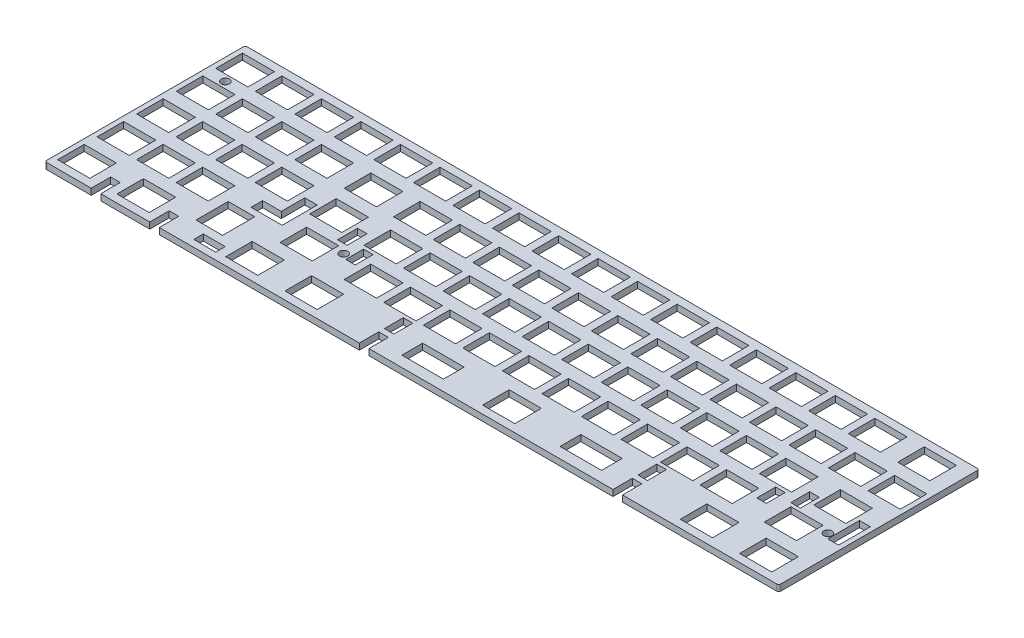
from build123d import *

# Parameters (mm, degrees)
SKETCH1_R           = 2
SKETCH1_W           = 10.6
SKETCH1_H           = 4.6
SKETCH1_W_2         = 4.6
SKETCH1_H_2         = 8.6
SKETCH1_H_3         = 9.6
SKETCH1_H_4         = 9.1
SKETCH1_W_3         = 5.2375
SKETCH1_H_5         = 15.35
SKETCH1_W_4         = 20
SKETCH1_H_6         = 10
SKETCH1_W_5         = 15.6
SKETCH1_H_7         = 12.8
SKETCH1_W_6         = 15.5
SKETCH1_W_7         = 12.8
SKETCH1_H_8         = 15.5
BOSS_EXTRUDE1_DEPTH = 3


with BuildPart() as part:
    # Sketch1 → Boss-Extrude1 (new body)
    with BuildSketch(Plane(origin=(0, 0, 0), x_dir=(1, 0, 0), z_dir=(0, 1, 0))):
        with BuildLine():
            Line((22.374999588, 5.73e-07), (22.374999588, 9.350000573))
            Line((22.374999588, 9.350000573), (26.974999588, 9.350000573))
            Line((26.974999588, 9.350000573), (26.974999588, 5.73e-07))
            Line((26.974999588, 5.73e-07), (50.574999588, 5.73e-07))
            Line((50.574999588, 5.73e-07), (50.574999588, 9.350000573))
            Line((50.574999588, 9.350000573), (55.174999588, 9.350000573))
            Line((55.174999588, 9.350000573), (55.174999588, 5.73e-07))
            Line((55.174999588, 5.73e-07), (151.587499588, 5.73e-07))
            Line((151.587499588, 5.73e-07), (151.587499588, 9.350000573))
            Line((151.587499588, 9.350000573), (156.187499588, 9.350000573))
            Line((156.187499588, 9.350000573), (156.187499588, 5.73e-07))
            Line((156.187499588, 5.73e-07), (273.787499588, 5.73e-07))
            Line((273.787499588, 5.73e-07), (273.787499588, 9.350000573))
            Line((273.787499588, 9.350000573), (278.387499588, 9.350000573))
            Line((278.387499588, 9.350000573), (278.387499588, 5.73e-07))
            Line((278.387499588, 5.73e-07), (352.674999588, 5.73e-07))
            ThreePointArc((352.674999588, 5.73e-07), (353.382106369, 0.292893792), (353.674999588, 1.000000573))
            Line((353.674999588, 1.000000573), (353.674999588, 95.600000573))
            ThreePointArc((353.674999588, 95.600000573), (353.382106369, 96.307107354), (352.674999588, 96.600000573))
            Line((352.674999588, 96.600000573), (0.999999588, 96.600000573))
            ThreePointArc((0.999999588, 96.600000573), (0.292892807, 96.307107354), (-4.12e-07, 95.600000573))
            Line((-4.12e-07, 95.600000573), (-4.12e-07, 1.000000573))
            ThreePointArc((-4.12e-07, 1.000000573), (0.292892807, 0.292893792), (0.999999588, 5.73e-07))
            Line((0.999999588, 5.73e-07), (22.374999588, 5.73e-07))
        make_face()
        with Locations(Location((343.868749588, 33.500000573, 0), (0, 0, 270))):
            Circle(SKETCH1_R, mode=Mode.SUBTRACT)
        with Locations(Location((110.506249588, 33.500000573, 0), (0, 0, 270))):
            Circle(SKETCH1_R, mode=Mode.SUBTRACT)
        with Locations(Location((10.149999588, 76.875000573, 0), (0, 0, 270))):
            Circle(SKETCH1_R, mode=Mode.SUBTRACT)
        Polygon((83.843749588, 47.450000573), (83.843749588, 30.525000573), (68.843749588, 30.525000573), (68.843749588, 36.125000573), (77.843749588, 36.125000573), (77.843749588, 47.450000573), align=None, mode=Mode.SUBTRACT)
        with Locations((73.749999588, 5.625000573)):
            Rectangle(SKETCH1_W, SKETCH1_H, mode=Mode.SUBTRACT)
        with Locations((115.706249588, 35.900000573)):
            Rectangle(SKETCH1_W_2, SKETCH1_H_2, mode=Mode.SUBTRACT)
        with Locations((105.543749588, 42.650000573)):
            Rectangle(SKETCH1_W_2, SKETCH1_H_3, mode=Mode.SUBTRACT)
        with Locations((153.887499588, 16.600000573)):
            Rectangle(SKETCH1_W_2, SKETCH1_H_4, mode=Mode.SUBTRACT)
        with Locations((276.087499588, 16.600000573)):
            Rectangle(SKETCH1_W_2, SKETCH1_H_4, mode=Mode.SUBTRACT)
        with Locations((324.431252401, 41.900000311)):
            Rectangle(SKETCH1_W_2, SKETCH1_H_4, mode=Mode.SUBTRACT)
        with Locations((314.268749588, 35.650000573)):
            Rectangle(SKETCH1_W_2, SKETCH1_H_4, mode=Mode.SUBTRACT)
        with Locations((348.749999588, 38.775000573)):
            Rectangle(SKETCH1_W_3, SKETCH1_H_5, mode=Mode.SUBTRACT)
        with Locations((176.887499588, 10.200000573)):
            Rectangle(SKETCH1_W_4, SKETCH1_H_6, mode=Mode.SUBTRACT)
        with Locations((253.087499588, 10.200000573)):
            Rectangle(SKETCH1_W_4, SKETCH1_H_6, mode=Mode.SUBTRACT)
        with Locations((129.212499588, 29.250000573)):
            Rectangle(SKETCH1_W_5, SKETCH1_H_7, mode=Mode.SUBTRACT)
        with Locations((119.687499588, 48.300000573)):
            Rectangle(SKETCH1_W_5, SKETCH1_H_7, mode=Mode.SUBTRACT)
        with Locations((114.924999588, 67.350000573)):
            Rectangle(SKETCH1_W_5, SKETCH1_H_7, mode=Mode.SUBTRACT)
        with Locations((338.762499588, 86.400000573)):
            Rectangle(SKETCH1_W_6, SKETCH1_H_7, mode=Mode.SUBTRACT)
        with Locations((314.949999588, 86.400000573)):
            Rectangle(SKETCH1_W_6, SKETCH1_H_7, mode=Mode.SUBTRACT)
        with Locations((295.899999588, 86.400000573)):
            Rectangle(SKETCH1_W_6, SKETCH1_H_7, mode=Mode.SUBTRACT)
        with Locations((276.849999588, 86.400000573)):
            Rectangle(SKETCH1_W_6, SKETCH1_H_7, mode=Mode.SUBTRACT)
        with Locations((257.799999588, 86.400000573)):
            Rectangle(SKETCH1_W_6, SKETCH1_H_7, mode=Mode.SUBTRACT)
        with Locations((238.749999588, 86.400000573)):
            Rectangle(SKETCH1_W_6, SKETCH1_H_7, mode=Mode.SUBTRACT)
        with Locations((219.699999588, 86.400000573)):
            Rectangle(SKETCH1_W_6, SKETCH1_H_7, mode=Mode.SUBTRACT)
        with Locations((200.649999588, 86.400000573)):
            Rectangle(SKETCH1_W_6, SKETCH1_H_7, mode=Mode.SUBTRACT)
        with Locations((181.599999588, 86.400000573)):
            Rectangle(SKETCH1_W_6, SKETCH1_H_7, mode=Mode.SUBTRACT)
        with Locations((162.549999588, 86.400000573)):
            Rectangle(SKETCH1_W_6, SKETCH1_H_7, mode=Mode.SUBTRACT)
        with Locations((143.499999588, 86.400000573)):
            Rectangle(SKETCH1_W_6, SKETCH1_H_7, mode=Mode.SUBTRACT)
        with Locations((124.449999588, 86.400000573)):
            Rectangle(SKETCH1_W_6, SKETCH1_H_7, mode=Mode.SUBTRACT)
        with Locations((105.399999588, 86.400000573)):
            Rectangle(SKETCH1_W_6, SKETCH1_H_7, mode=Mode.SUBTRACT)
        with Locations((86.349999588, 86.400000573)):
            Rectangle(SKETCH1_W_6, SKETCH1_H_7, mode=Mode.SUBTRACT)
        with Locations((67.299999588, 86.400000573)):
            Rectangle(SKETCH1_W_6, SKETCH1_H_7, mode=Mode.SUBTRACT)
        with Locations((48.249999588, 86.400000573)):
            Rectangle(SKETCH1_W_6, SKETCH1_H_7, mode=Mode.SUBTRACT)
        with Locations((29.199999588, 86.400000573)):
            Rectangle(SKETCH1_W_6, SKETCH1_H_7, mode=Mode.SUBTRACT)
        with Locations((10.149999588, 86.400000573)):
            Rectangle(SKETCH1_W_6, SKETCH1_H_7, mode=Mode.SUBTRACT)
        with Locations((67.299999588, 67.350000573)):
            Rectangle(SKETCH1_W_6, SKETCH1_H_7, mode=Mode.SUBTRACT)
        with Locations((48.249999588, 67.350000573)):
            Rectangle(SKETCH1_W_6, SKETCH1_H_7, mode=Mode.SUBTRACT)
        with Locations((29.199999588, 67.350000573)):
            Rectangle(SKETCH1_W_6, SKETCH1_H_7, mode=Mode.SUBTRACT)
        with Locations((10.149999588, 67.350000573)):
            Rectangle(SKETCH1_W_6, SKETCH1_H_7, mode=Mode.SUBTRACT)
        with Locations((67.249999588, 48.300000573)):
            Rectangle(SKETCH1_W_6, SKETCH1_H_7, mode=Mode.SUBTRACT)
        with Locations((48.199999588, 48.300000573)):
            Rectangle(SKETCH1_W_6, SKETCH1_H_7, mode=Mode.SUBTRACT)
        with Locations((29.149999588, 48.300000573)):
            Rectangle(SKETCH1_W_6, SKETCH1_H_7, mode=Mode.SUBTRACT)
        with Locations((10.099999588, 48.300000573)):
            Rectangle(SKETCH1_W_6, SKETCH1_H_7, mode=Mode.SUBTRACT)
        with Locations((48.199999588, 29.250000573)):
            Rectangle(SKETCH1_W_6, SKETCH1_H_7, mode=Mode.SUBTRACT)
        with Locations((29.149999588, 29.250000573)):
            Rectangle(SKETCH1_W_6, SKETCH1_H_7, mode=Mode.SUBTRACT)
        with Locations((10.099999588, 29.250000573)):
            Rectangle(SKETCH1_W_6, SKETCH1_H_7, mode=Mode.SUBTRACT)
        with Locations((10.149999588, 10.200000573)):
            Rectangle(SKETCH1_W_6, SKETCH1_H_7, mode=Mode.SUBTRACT)
        with Locations((38.724999588, 10.200000573)):
            Rectangle(SKETCH1_W_6, SKETCH1_H_7, mode=Mode.SUBTRACT)
        with Locations((91.112499588, 10.200000573)):
            Rectangle(SKETCH1_W_6, SKETCH1_H_7, mode=Mode.SUBTRACT)
        with Locations((119.687499588, 10.200000573)):
            Rectangle(SKETCH1_W_6, SKETCH1_H_7, mode=Mode.SUBTRACT)
        with Locations((98.256249588, 29.250000573)):
            Rectangle(SKETCH1_W_6, SKETCH1_H_7, mode=Mode.SUBTRACT)
        with Locations((93.493749588, 48.300000573)):
            Rectangle(SKETCH1_W_6, SKETCH1_H_7, mode=Mode.SUBTRACT)
        with Locations((91.112499588, 67.350000573)):
            Rectangle(SKETCH1_W_6, SKETCH1_H_7, mode=Mode.SUBTRACT)
        with Locations((336.381249588, 48.300000573)):
            Rectangle(SKETCH1_W_6, SKETCH1_H_7, mode=Mode.SUBTRACT)
        with Locations((214.937499588, 10.200000573)):
            Rectangle(SKETCH1_W_6, SKETCH1_H_7, mode=Mode.SUBTRACT)
        with Locations((310.187499588, 10.200000573)):
            Rectangle(SKETCH1_W_6, SKETCH1_H_7, mode=Mode.SUBTRACT)
        with Locations((331.618749588, 29.250000573)):
            Rectangle(SKETCH1_W_6, SKETCH1_H_7, mode=Mode.SUBTRACT)
        with Locations((338.762499588, 10.200000573)):
            Rectangle(SKETCH1_W_6, SKETCH1_H_7, mode=Mode.SUBTRACT)
        with Locations((67.299999588, 19.725000573)):
            Rectangle(SKETCH1_W_7, SKETCH1_H_8, mode=Mode.SUBTRACT)
        with Locations((286.374999588, 67.350000573)):
            Rectangle(SKETCH1_W_6, SKETCH1_H_7, mode=Mode.SUBTRACT)
        with Locations((267.324999588, 67.350000573)):
            Rectangle(SKETCH1_W_6, SKETCH1_H_7, mode=Mode.SUBTRACT)
        with Locations((248.274999588, 67.350000573)):
            Rectangle(SKETCH1_W_6, SKETCH1_H_7, mode=Mode.SUBTRACT)
        with Locations((229.224999588, 67.350000573)):
            Rectangle(SKETCH1_W_6, SKETCH1_H_7, mode=Mode.SUBTRACT)
        with Locations((210.174999588, 67.350000573)):
            Rectangle(SKETCH1_W_6, SKETCH1_H_7, mode=Mode.SUBTRACT)
        with Locations((191.124999588, 67.350000573)):
            Rectangle(SKETCH1_W_6, SKETCH1_H_7, mode=Mode.SUBTRACT)
        with Locations((172.074999588, 67.350000573)):
            Rectangle(SKETCH1_W_6, SKETCH1_H_7, mode=Mode.SUBTRACT)
        with Locations((153.024999588, 67.350000573)):
            Rectangle(SKETCH1_W_6, SKETCH1_H_7, mode=Mode.SUBTRACT)
        with Locations((133.974999588, 67.350000573)):
            Rectangle(SKETCH1_W_6, SKETCH1_H_7, mode=Mode.SUBTRACT)
        with Locations((291.137499588, 48.300000573)):
            Rectangle(SKETCH1_W_6, SKETCH1_H_7, mode=Mode.SUBTRACT)
        with Locations((272.087499588, 48.300000573)):
            Rectangle(SKETCH1_W_6, SKETCH1_H_7, mode=Mode.SUBTRACT)
        with Locations((253.037499588, 48.300000573)):
            Rectangle(SKETCH1_W_6, SKETCH1_H_7, mode=Mode.SUBTRACT)
        with Locations((233.987499588, 48.300000573)):
            Rectangle(SKETCH1_W_6, SKETCH1_H_7, mode=Mode.SUBTRACT)
        with Locations((214.937499588, 48.300000573)):
            Rectangle(SKETCH1_W_6, SKETCH1_H_7, mode=Mode.SUBTRACT)
        with Locations((195.887499588, 48.300000573)):
            Rectangle(SKETCH1_W_6, SKETCH1_H_7, mode=Mode.SUBTRACT)
        with Locations((176.837499588, 48.300000573)):
            Rectangle(SKETCH1_W_6, SKETCH1_H_7, mode=Mode.SUBTRACT)
        with Locations((157.787499588, 48.300000573)):
            Rectangle(SKETCH1_W_6, SKETCH1_H_7, mode=Mode.SUBTRACT)
        with Locations((138.737499588, 48.300000573)):
            Rectangle(SKETCH1_W_6, SKETCH1_H_7, mode=Mode.SUBTRACT)
        with Locations((300.662499588, 29.250000573)):
            Rectangle(SKETCH1_W_6, SKETCH1_H_7, mode=Mode.SUBTRACT)
        with Locations((281.612499588, 29.250000573)):
            Rectangle(SKETCH1_W_6, SKETCH1_H_7, mode=Mode.SUBTRACT)
        with Locations((262.562499588, 29.250000573)):
            Rectangle(SKETCH1_W_6, SKETCH1_H_7, mode=Mode.SUBTRACT)
        with Locations((243.512499588, 29.250000573)):
            Rectangle(SKETCH1_W_6, SKETCH1_H_7, mode=Mode.SUBTRACT)
        with Locations((224.462499588, 29.250000573)):
            Rectangle(SKETCH1_W_6, SKETCH1_H_7, mode=Mode.SUBTRACT)
        with Locations((205.412499588, 29.250000573)):
            Rectangle(SKETCH1_W_6, SKETCH1_H_7, mode=Mode.SUBTRACT)
        with Locations((186.362499588, 29.250000573)):
            Rectangle(SKETCH1_W_6, SKETCH1_H_7, mode=Mode.SUBTRACT)
        with Locations((167.312499588, 29.250000573)):
            Rectangle(SKETCH1_W_6, SKETCH1_H_7, mode=Mode.SUBTRACT)
        with Locations((148.262499588, 29.250000573)):
            Rectangle(SKETCH1_W_6, SKETCH1_H_7, mode=Mode.SUBTRACT)
        with Locations((343.524999588, 67.350000573)):
            Rectangle(SKETCH1_W_6, SKETCH1_H_7, mode=Mode.SUBTRACT)
        with Locations((324.474999588, 67.350000573)):
            Rectangle(SKETCH1_W_6, SKETCH1_H_7, mode=Mode.SUBTRACT)
        with Locations((305.424999588, 67.350000573)):
            Rectangle(SKETCH1_W_6, SKETCH1_H_7, mode=Mode.SUBTRACT)
        with Locations((310.187499588, 48.300000573)):
            Rectangle(SKETCH1_W_6, SKETCH1_H_7, mode=Mode.SUBTRACT)
    extrude(amount=-BOSS_EXTRUDE1_DEPTH)


solid = part.part
